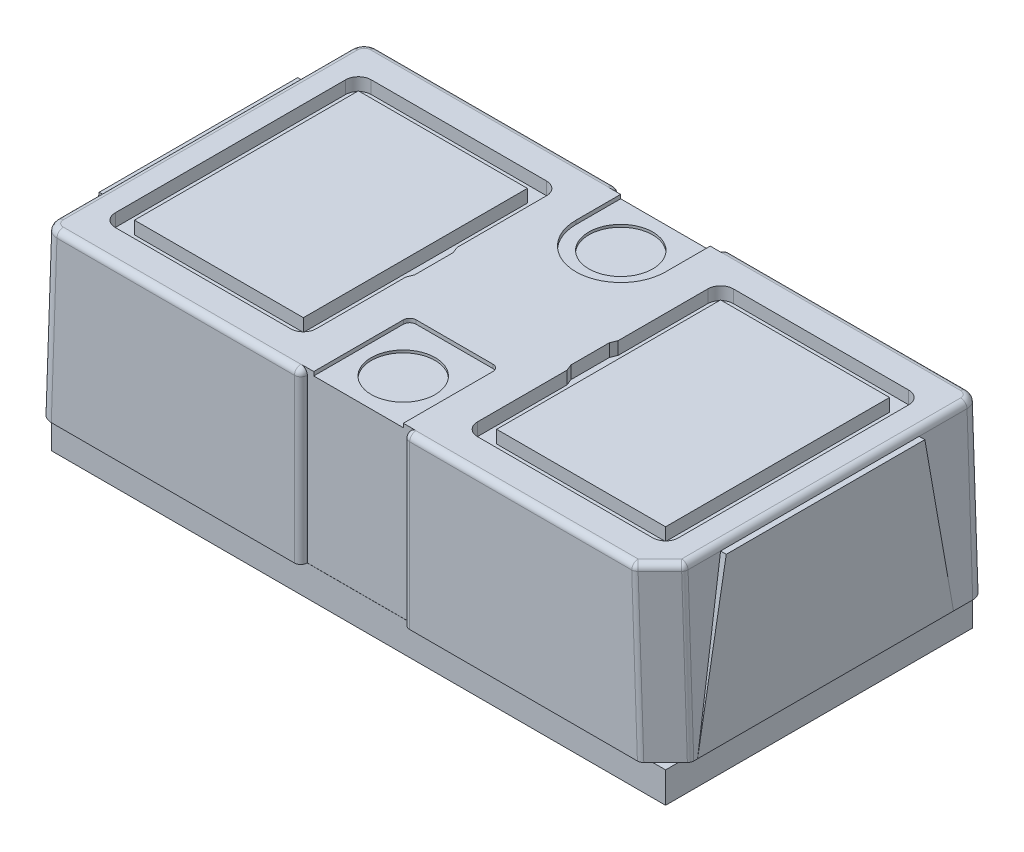
from build123d import *

# Parameters (mm, degrees)
SKETCH1_W               = 4.8
SKETCH1_H               = 2.4
BOSS_EXTRUDE1_DEPTH     = 0.24
SKETCH2_W               = 0.5
SKETCH2_H               = 0.5
BOSS_EXTRUDE2_DEPTH     = 0.01
SKETCH3_W               = 4.9
SKETCH3_H               = 2.5
BOSS_EXTRUDE3_DEPTH     = 1.32
BOSS_EXTRUDE3_TAPER     = 2
BOSS_EXTRUDE5_DEPTH     = 1.25
FILLET1_R               = 0.1
CUT_EXTRUDE2_DEPTH      = 6.681134545
CUT_EXTRUDE2_DEPTH_BACK = 6.681134545
SKETCH10_W              = 0.8
SKETCH10_H              = 0.051
CUT_EXTRUDE3_DEPTH      = 4.050803173
FILLET2_R               = 0.05
BOSS_EXTRUDE4_DEPTH     = 2.45
CUT_EXTRUDE4_DEPTH      = 0.03
SKETCH13_R              = 0.25
CUT_EXTRUDE5_DEPTH      = 0.05
SKETCH15_W              = 1.32
SKETCH15_H              = 1.75
CUT_EXTRUDE6_DEPTH      = 0.1


with BuildPart() as part:
    # Sketch1 → Boss-Extrude1 (new body)
    with BuildSketch(Plane(origin=(0, 0, 0), x_dir=(1, 0, 0), z_dir=(0, 1, 0))):
        Rectangle(SKETCH1_W, SKETCH1_H)
    extrude(amount=BOSS_EXTRUDE1_DEPTH)

    # Sketch2 → Boss-Extrude2 (add)
    with BuildSketch(Plane.XZ):
        with Locations((-1.6, 0.8)):
            Rectangle(SKETCH2_W, SKETCH2_H)
        with Locations((-0.8, 0.8)):
            Rectangle(SKETCH2_W, SKETCH2_H)
        with Locations((0, 0.8)):
            Rectangle(SKETCH2_W, SKETCH2_H)
        with Locations((0.8, 0.8)):
            Rectangle(SKETCH2_W, SKETCH2_H)
        with Locations((1.6, 0.8)):
            Rectangle(SKETCH2_W, SKETCH2_H)
        with Locations((-1.6, 0)):
            Rectangle(SKETCH2_W, SKETCH2_H)
        Polygon((-1.93, -0.55), (-1.35, -0.55), (-1.35, -1.05), (-1.85, -1.05), (-1.85, -0.8), (-1.93, -0.8), align=None)
        with Locations((-0.8, -0.8)):
            Rectangle(SKETCH2_W, SKETCH2_H)
        with Locations((0, -0.8)):
            Rectangle(SKETCH2_W, SKETCH2_H)
        with Locations((0.8, -0.8)):
            Rectangle(SKETCH2_W, SKETCH2_H)
        with Locations((1.6, -0.8)):
            Rectangle(SKETCH2_W, SKETCH2_H)
        with Locations((1.6, 0)):
            Rectangle(SKETCH2_W, SKETCH2_H)
    extrude(amount=BOSS_EXTRUDE2_DEPTH)

    # Sketch3 → Boss-Extrude3 (add)
    with BuildSketch(Plane(origin=(0, 0.24, 0), x_dir=(1, 0, 0), z_dir=(0, 1, 0))):
        Rectangle(SKETCH3_W, SKETCH3_H)
    extrude(amount=BOSS_EXTRUDE3_DEPTH, taper=BOSS_EXTRUDE3_TAPER)

    # Sketch11 → Boss-Extrude5 (add, symmetric)
    with BuildSketch(Plane.XY):
        Polygon((2.45, 0.24), (2.403904584, 1.56), (-2.403904584, 1.56), (-2.45, 0.24), align=None)
    extrude(amount=BOSS_EXTRUDE5_DEPTH, both=True)

    # Fillet1
    fillet1_edges = [part.edges().sort_by_distance(p)[0] for p in [
        (2.426952292, 0.9, -1.25),
        (-2.426952292, 0.9, -1.25),
        (-2.426952292, 0.9, 1.25),
    ]]
    fillet(fillet1_edges, radius=FILLET1_R)

    # Sketch6 → Cut-Extrude2 (cut, two sides: drawn at the far end of the back side and taken through both)
    with BuildSketch(Plane(origin=(2.403904584, 1.56, 1.25), x_dir=(-0.7071067811865516, 0, -0.7071067811865435), z_dir=(0.7071067811865435, 0, -0.7071067811865516)).offset(-CUT_EXTRUDE2_DEPTH_BACK)):
        Polygon((-0.032594381, -1.32), (0, 0), (0.141042979, 0), (0.108448598, -1.32), align=None)
    extrude(amount=CUT_EXTRUDE2_DEPTH + CUT_EXTRUDE2_DEPTH_BACK, mode=Mode.SUBTRACT)

    # Sketch10 → Cut-Extrude3 (cut, through all)
    with BuildSketch(Plane.XZ.offset(-0.24)):
        with Locations((0, 1.2245)):
            Rectangle(SKETCH10_W, SKETCH10_H)
        with Locations((0, -1.2245)):
            Rectangle(SKETCH10_W, SKETCH10_H)
    extrude(amount=-CUT_EXTRUDE3_DEPTH, mode=Mode.SUBTRACT)

    # Fillet2
    fillet2_edges = [part.edges().sort_by_distance(p)[0] for p in [
        (-2.403904584, 1.56, 0),
        (1.351921815, 1.56, -1.25),
        (2.403904584, 1.56, -0.049732447),
        (-2.37458663, 1.56, 1.220721449),
        (2.37458663, 1.56, -1.220721449),
        (-2.37458663, 1.56, -1.220721449),
        (1.302219845, 1.56, 1.25),
        (2.227487398, 0.9, 1.25),
        (2.304172137, 1.56, 1.150267553),
        (2.426952292, 0.9, 1.050535106),
        (-1.351921815, 1.56, 1.25),
        (-1.351921815, 1.56, -1.25),
        (-0.4, 1.56, 1.2245),
        (-0.4, 0.9, 1.25),
        (0.4, 1.56, 1.2245),
        (0.4, 0.9, 1.25),
        (-0.4, 1.56, -1.2245),
        (-0.4, 0.9, -1.25),
        (0.4, 1.56, -1.2245),
        (0.4, 0.9, -1.25),
    ]]
    fillet(fillet2_edges, radius=FILLET2_R)

    # Sketch9 → Boss-Extrude4 (add, symmetric)
    with BuildSketch(Plane(origin=(0, 0, 0), x_dir=(0, 0, -1), z_dir=(1, 0, 0))):
        Polygon((-1, 0.24), (-0.775757048, 1.511744975), (0.775757048, 1.511744975), (1, 0.24), align=None)
    extrude(amount=BOSS_EXTRUDE4_DEPTH, both=True)

    # Sketch12 → Cut-Extrude4 (cut)
    with BuildSketch(Plane(origin=(0, 1.56, 0), x_dir=(1, 0, 0), z_dir=(0, 1, 0))):
        with BuildLine():
            Line((-0.35, -1.199), (0.35, -1.199))
            Line((0.35, -1.199), (0.35, -0.499))
            ThreePointArc((0.35, -0.499), (0.335355339, -0.463644661), (0.3, -0.449))
            Line((0.3, -0.449), (-0.3, -0.449))
            ThreePointArc((-0.3, -0.449), (-0.335355339, -0.463644661), (-0.35, -0.499))
            Line((-0.35, -0.499), (-0.35, -1.199))
        make_face()
        with BuildLine():
            Line((-0.35, 1.199), (0.35, 1.199))
            Line((0.35, 1.199), (0.35, 0.85))
            ThreePointArc((0.35, 0.85), (0, 0.5), (-0.35, 0.85))
            Line((-0.35, 0.85), (-0.35, 1.199))
        make_face()
    extrude(amount=-CUT_EXTRUDE4_DEPTH, mode=Mode.SUBTRACT)

    # Sketch13 → Cut-Extrude5 (cut)
    with BuildSketch(Plane(origin=(0, 1.56, 0), x_dir=(1, 0, 0), z_dir=(0, 1, 0))):
        with Locations(Location((0, 0.85, 0), (0, 0, 270))):
            Circle(SKETCH13_R)
        with Locations(Location((0, -0.85, 0), (0, 0, 270))):
            Circle(SKETCH13_R)
    extrude(amount=-CUT_EXTRUDE5_DEPTH, mode=Mode.SUBTRACT)

    # Sketch15 → Cut-Extrude6 (cut)
    # profile 1 of 2: a face of its own
    with BuildSketch(Plane(origin=(0, 1.56, 0), x_dir=(1, 0, 0), z_dir=(0, 1, 0))):
        with BuildLine():
            Line((-2.1, 1), (-0.73, 1))
            ThreePointArc((-0.73, 1), (-0.659289322, 0.970710678), (-0.63, 0.9))
            Line((-0.63, 0.9), (-0.63, 0.2))
            Line((-0.63, 0.2), (-0.61, 0.15))
            Line((-0.61, 0.15), (-0.61, -0.15))
            Line((-0.61, -0.15), (-0.63, -0.2))
            Line((-0.63, -0.2), (-0.63, -0.9))
            ThreePointArc((-0.63, -0.9), (-0.659289322, -0.970710678), (-0.73, -1))
            Line((-0.73, -1), (-2.1, -1))
            ThreePointArc((-2.1, -1), (-2.170710678, -0.970710678), (-2.2, -0.9))
            Line((-2.2, -0.9), (-2.2, 0.9))
            ThreePointArc((-2.2, 0.9), (-2.170710678, 0.970710678), (-2.1, 1))
        make_face()
        with Locations((-1.415, 0)):
            Rectangle(SKETCH15_W, SKETCH15_H, mode=Mode.SUBTRACT)
    # profile 2 of 2: a face of its own
    with BuildSketch(Plane(origin=(0, 1.56, 0), x_dir=(1, 0, 0), z_dir=(0, 1, 0))):
        with BuildLine():
            Line((0.73, 1), (2.1, 1))
            ThreePointArc((2.1, 1), (2.170710678, 0.970710678), (2.2, 0.9))
            Line((2.2, 0.9), (2.2, -0.9))
            ThreePointArc((2.2, -0.9), (2.170710678, -0.970710678), (2.1, -1))
            Line((2.1, -1), (0.73, -1))
            ThreePointArc((0.73, -1), (0.659289322, -0.970710678), (0.63, -0.9))
            Line((0.63, -0.9), (0.63, -0.2))
            Line((0.63, -0.2), (0.61, -0.15))
            Line((0.61, -0.15), (0.61, 0.15))
            Line((0.61, 0.15), (0.63, 0.2))
            Line((0.63, 0.2), (0.63, 0.9))
            ThreePointArc((0.63, 0.9), (0.659289322, 0.970710678), (0.73, 1))
        make_face()
        with Locations((1.415, 0)):
            Rectangle(SKETCH15_W, SKETCH15_H, mode=Mode.SUBTRACT)
    extrude(amount=-CUT_EXTRUDE6_DEPTH, mode=Mode.SUBTRACT)


solid = part.part
